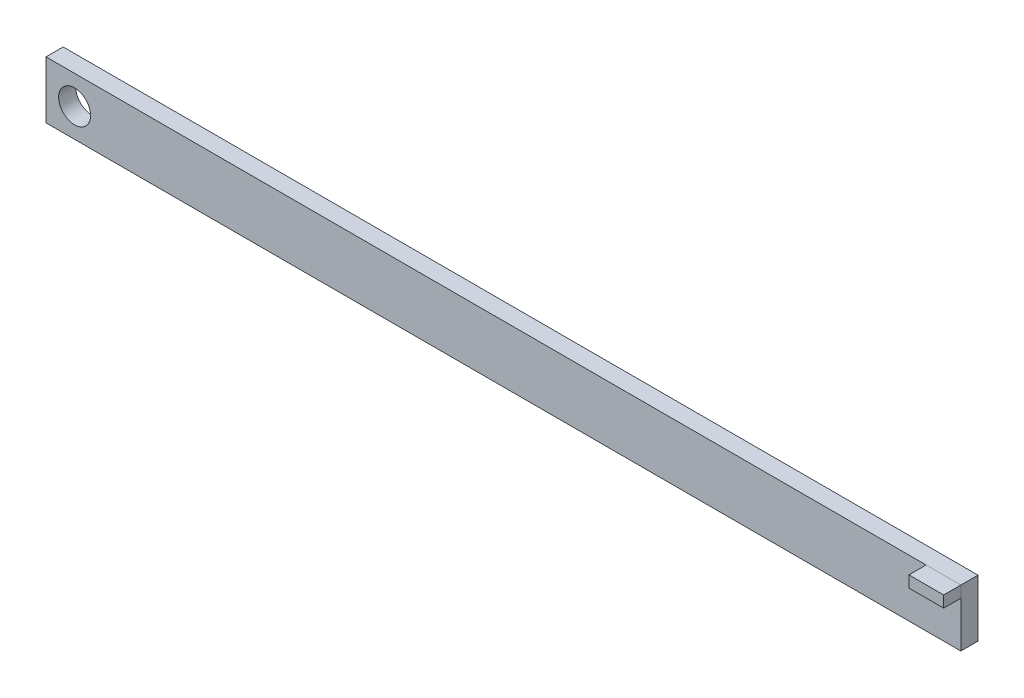
from build123d import *

# Parameters (mm, degrees)
BOSS_EXTRUDE1_DEPTH = 3
SKETCH2_W           = 6.077925367
SKETCH2_H           = 2
BOSS_EXTRUDE2_DEPTH = 3


with BuildPart() as part:
    # Sketch1 → Boss-Extrude1 (new body)
    with BuildSketch(Plane.XY.offset(89.9)):
        Polygon((65, 16), (220, 16), (220, 26), (65, 26), (60, 26), (60, 16), align=None)
        with BuildLine():
            ThreePointArc((65, 18.2), (67.8, 21), (65, 23.8))
            ThreePointArc((65, 23.8), (62.2, 21), (65, 18.2))
        make_face(mode=Mode.SUBTRACT)
    extrude(amount=BOSS_EXTRUDE1_DEPTH)


with BuildPart() as body_2:
    # Sketch2 → Boss-Extrude2 (new body)
    with BuildSketch(Plane.XY.offset(92.9)):
        with Locations((216.961037317, 25)):
            Rectangle(SKETCH2_W, SKETCH2_H)
    extrude(amount=BOSS_EXTRUDE2_DEPTH)


solid = Compound([part.part, body_2.part])
